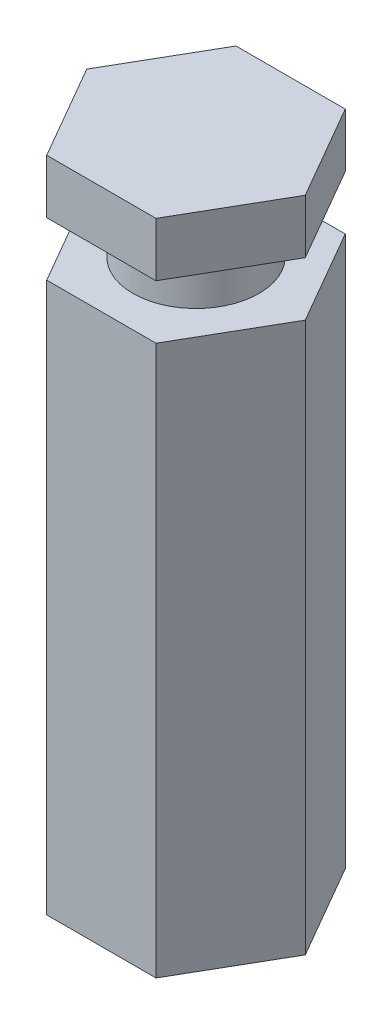
from build123d import *

# Parameters (mm, degrees)
SKETCH1_R           = 7
BOSS_EXTRUDE1_DEPTH = 61
SKETCH1_3_R         = 7
BOSS_EXTRUDE2_DEPTH = 67
BOSS_EXTRUDE3_START = 67
SKETCH1_4_R         = 7
BOSS_EXTRUDE3_DEPTH = 6


with BuildPart() as part:
    # Sketch1 → Boss-Extrude1 (new body)
    # profile 1 of 2: a face of its own
    with BuildSketch(Plane(origin=(0, 0, 0), x_dir=(1, 0, 0), z_dir=(0, 1, 0))):
        Polygon((-6.062177826, -10.5), (6.062177826, -10.5), (12.124355653, 0), (6.062177826, 10.5), (-6.062177826, 10.5), (-12.124355653, 0), align=None)
        Circle(SKETCH1_R, mode=Mode.SUBTRACT)
    # profile 2 of 2: a face of its own
    with BuildSketch(Plane(origin=(0, 0, 0), x_dir=(1, 0, 0), z_dir=(0, 1, 0))):
        Circle(SKETCH1_R)
    extrude(amount=BOSS_EXTRUDE1_DEPTH)

    # Sketch1<3> → Boss-Extrude2 (add)
    with BuildSketch(Plane(origin=(0, 0, 0), x_dir=(1, 0, 0), z_dir=(0, 1, 0))):
        with Locations(Location((0, 0, 0), (0, 0, 270))):
            Circle(SKETCH1_3_R)
    extrude(amount=BOSS_EXTRUDE2_DEPTH)

    # Sketch1<4> → Boss-Extrude3 (add)
    # profile 1 of 2: a face of its own
    with BuildSketch(Plane(origin=(0, 0, 0), x_dir=(1, 0, 0), z_dir=(0, 1, 0)).offset(BOSS_EXTRUDE3_START)):
        Polygon((-6.062177826, -10.5), (6.062177826, -10.5), (12.124355653, 0), (6.062177826, 10.5), (-6.062177826, 10.5), (-12.124355653, 0), align=None)
        with Locations(Location((0, 0, 0), (0, 0, 270))):
            Circle(SKETCH1_4_R, mode=Mode.SUBTRACT)
    # profile 2 of 2: a face of its own
    with BuildSketch(Plane(origin=(0, 0, 0), x_dir=(1, 0, 0), z_dir=(0, 1, 0)).offset(BOSS_EXTRUDE3_START)):
        with Locations(Location((0, 0, 0), (0, 0, 270))):
            Circle(SKETCH1_4_R)
    extrude(amount=BOSS_EXTRUDE3_DEPTH)


solid = part.part
